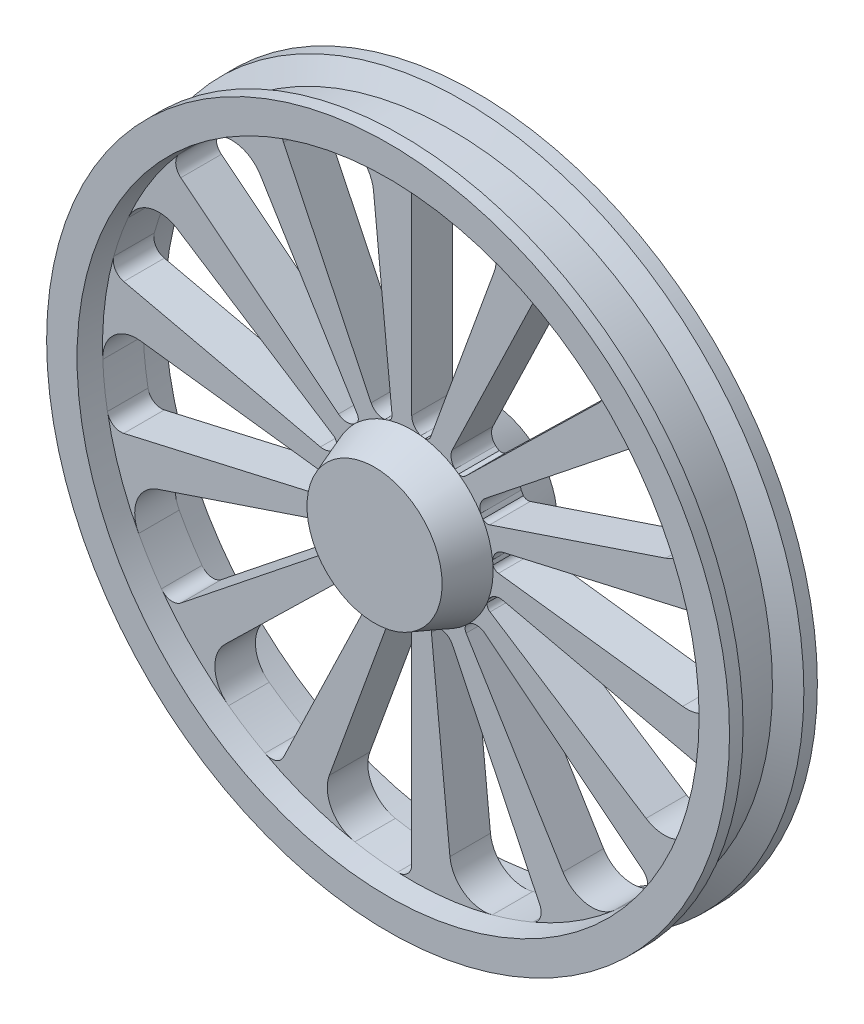
from build123d import *

# Parameters (mm, degrees)
CUT_EXTRUDE1_DEPTH = 265


with BuildPart() as part:
    # Sketch1 → Revolve1 (revolve)
    with BuildSketch(Plane(origin=(0, 0, 0), x_dir=(0, 0, -1), z_dir=(1, 0, 0)), mode=Mode.PRIVATE) as revolve1_sk:
        Polygon((-85, 0), (-85, 100), (-30, 120.407271829), (-30, 457.5), (-65, 460.254556655), (-65, 505.254556655), (-45, 505.254556655), (-28.508256592, 475.254556655), (28.508256592, 475.254556655), (45, 505.254556655), (65, 505.254556655), (65, 460.254556655), (30, 457.5), (30, 120.407271829), (85, 100), (85, 0), align=None)
    revolve(revolve1_sk.sketch.rotate(Axis((0, 0, 374.636327729), (0, 0, -1)), 90), axis=Axis((0, 0, 374.636327729), (0, 0, -1)))

    # Sketch2 → Cut-Extrude1 (cut)
    with BuildSketch(Plane.XY.offset(30)):
        with BuildLine():
            ThreePointArc((0, 138.564064606), (3.723460634, 126.941919095), (13.507426626, 119.647233714))
            ThreePointArc((13.507426626, 119.647233714), (16.703287524, 119.243076509), (19.887193054, 118.753571154))
            ThreePointArc((19.887193054, 118.753571154), (24.834793435, 120.871103176), (27.968354779, 125.246429986))
            Line((27.968354779, 125.246429986), (121.944990015, 383.445113252))
            ThreePointArc((121.944990015, 383.445113252), (118.391940375, 425.319043886), (84.157949034, 449.69288366))
            ThreePointArc((84.157949034, 449.69288366), (52.663759357, 454.458775304), (20.914285714, 457.02170917))
            ThreePointArc((20.914285714, 457.02170917), (6.184894396, 451.504390328), (0, 437.042618059))
            Line((0, 437.042618059), (0, 138.564064606))
        make_face()
        with BuildLine():
            ThreePointArc((60.120694458, 124.84190842), (58.43275662, 112.755168114), (64.082760015, 101.937779936))
            ThreePointArc((64.082760015, 101.937779936), (66.78677395, 100.187014801), (69.442985298, 98.364540879))
            ThreePointArc((69.442985298, 98.364540879), (74.819381923, 98.125687955), (79.541006296, 100.708119885))
            Line((79.541006296, 100.708119885), (276.239239084, 292.562161355))
            ThreePointArc((276.239239084, 292.562161355), (291.206469568, 331.830879696), (270.938121883, 368.644522692))
            ThreePointArc((270.938121883, 368.644522692), (244.630680351, 386.603259468), (217.137408356, 402.687963431))
            ThreePointArc((217.137408356, 402.687963431), (201.472810405, 404.1078743), (189.625685277, 393.761792818))
            Line((189.625685277, 393.761792818), (60.120694458, 124.84190842))
        make_face()
        with BuildLine():
            ThreePointArc((108.333748047, 86.393281186), (101.568728526, 76.235873237), (101.965716859, 64.038298657))
            ThreePointArc((101.965716859, 64.038298657), (103.64232071, 61.287686099), (105.244742641, 58.493206921))
            ThreePointArc((105.244742641, 58.493206921), (109.985074222, 55.945276802), (115.35958601, 56.223331536))
            Line((115.35958601, 56.223331536), (375.820919001, 143.733685362))
            ThreePointArc((375.820919001, 143.733685362), (406.343986049, 172.619540143), (404.055676855, 214.581592876))
            ThreePointArc((404.055676855, 214.581592876), (388.145494903, 242.176226717), (370.353804257, 268.596927891))
            ThreePointArc((370.353804257, 268.596927891), (356.856565412, 276.672837709), (341.693677979, 272.491615338))
            Line((341.693677979, 272.491615338), (108.333748047, 86.393281186))
        make_face()
        with BuildLine():
            ThreePointArc((135.089974209, 30.833405069), (124.58776809, 24.617128693), (119.653112951, 13.455246951))
            ThreePointArc((119.653112951, 13.455246951), (119.970234763, 10.249579521), (120.201487962, 7.03657596))
            ThreePointArc((120.201487962, 7.03657596), (123.366873693, 2.684217454), (128.329784921, 0.602822843))
            Line((128.329784921, 0.602822843), (400.966656769, -33.563009794))
            ThreePointArc((400.966656769, -33.563009794), (441.000092612, -20.781216374), (457.145049608, 18.01814692))
            ThreePointArc((457.145049608, 18.01814692), (454.783333897, 49.783222168), (450.217087133, 81.306976657))
            ThreePointArc((450.217087133, 81.306976657), (441.56050108, 94.439352441), (426.085047159, 97.251131549))
            Line((426.085047159, 97.251131549), (135.089974209, 30.833405069))
        make_face()
        with BuildLine():
            ThreePointArc((346.69603063, -204.212139238), (388.310722322, -210.065998124), (419.691238771, -182.114014011))
            ThreePointArc((419.691238771, -182.114014011), (431.345756062, -152.469960083), (440.909354353, -122.086818469))
            ThreePointArc((440.909354353, -122.086818469), (438.807964126, -106.499004801), (426.085047159, -97.251131549))
            Line((426.085047159, -97.251131549), (135.089974209, -30.833405069))
            ThreePointArc((135.089974209, -30.833405069), (122.930672214, -31.877340097), (113.641742575, -39.792781431))
            ThreePointArc((113.641742575, -39.792781431), (112.536572483, -42.818581985), (111.350854417, -45.813735168))
            ThreePointArc((111.350854417, -45.813735168), (112.314350833, -51.10848408), (115.882696068, -55.137082307))
            Line((115.882696068, -55.137082307), (346.69603063, -204.212139238))
        make_face()
        with BuildLine():
            ThreePointArc((223.758003677, -334.414550008), (258.711651157, -357.744632655), (299.112430919, -346.176260985))
            ThreePointArc((299.112430919, -346.176260985), (322.47486113, -324.524596817), (344.274116545, -301.299821901))
            ThreePointArc((344.274116545, -301.299821901), (349.144128249, -286.343928018), (341.693677979, -272.491615338))
            Line((341.693677979, -272.491615338), (108.333748047, -86.393281186))
            ThreePointArc((108.333748047, -86.393281186), (96.925649061, -82.058110732), (85.122231357, -85.159361425))
            ThreePointArc((85.122231357, -85.159361425), (82.813661852, -87.405998192), (80.445818527, -89.590074177))
            ThreePointArc((80.445818527, -89.590074177), (79.016593346, -94.778523538), (80.48361805, -99.956412095))
            Line((80.48361805, -99.956412095), (223.758003677, -334.414550008))
        make_face()
        with BuildLine():
            ThreePointArc((56.501959884, -398.382057824), (77.871564591, -434.567555239), (119.290737751, -441.674053898))
            ThreePointArc((119.290737751, -441.674053898), (149.733865056, -432.303157119), (179.45116771, -420.836700405))
            ThreePointArc((179.45116771, -420.836700405), (190.328015801, -409.474924513), (189.625685277, -393.761792818))
            Line((189.625685277, -393.761792818), (60.120694458, -124.84190842))
            ThreePointArc((60.120694458, -124.84190842), (51.723312396, -115.986266159), (39.743218263, -113.659085477))
            ThreePointArc((39.743218263, -113.659085477), (36.688489849, -114.681584494), (33.607501674, -115.622000245))
            ThreePointArc((33.607501674, -115.622000245), (30.068630472, -119.676514027), (29.143772411, -124.978148582))
            Line((29.143772411, -124.978148582), (56.501959884, -398.382057824))
        make_face()
        with BuildLine():
            ThreePointArc((-20.914285714, -457.02170917), (-6.184894396, -451.504390328), (0, -437.042618059))
            Line((0, -437.042618059), (0, -138.564064606))
            ThreePointArc((0, -138.564064606), (-3.723460634, -126.941919095), (-13.507426626, -119.647233714))
            ThreePointArc((-13.507426626, -119.647233714), (-16.703287524, -119.243076509), (-19.887193054, -118.753571154))
            ThreePointArc((-19.887193054, -118.753571154), (-24.834793435, -120.871103176), (-27.968354779, -125.246429986))
            Line((-27.968354779, -125.246429986), (-121.944990015, -383.445113252))
            ThreePointArc((-121.944990015, -383.445113252), (-118.391940375, -425.319043886), (-84.157949034, -449.69288366))
            ThreePointArc((-84.157949034, -449.69288366), (-52.663759357, -454.458775304), (-20.914285714, -457.02170917))
        make_face()
        with BuildLine():
            ThreePointArc((-270.938121883, -368.644522692), (-244.630680351, -386.603259468), (-217.137408356, -402.687963431))
            ThreePointArc((-217.137408356, -402.687963431), (-201.472810405, -404.1078743), (-189.625685277, -393.761792818))
            Line((-189.625685277, -393.761792818), (-60.120694458, -124.84190842))
            ThreePointArc((-60.120694458, -124.84190842), (-58.43275662, -112.755168114), (-64.082760015, -101.937779936))
            ThreePointArc((-64.082760015, -101.937779936), (-66.78677395, -100.187014801), (-69.442985298, -98.364540879))
            ThreePointArc((-69.442985298, -98.364540879), (-74.819381923, -98.125687955), (-79.541006296, -100.708119885))
            Line((-79.541006296, -100.708119885), (-276.239239084, -292.562161355))
            ThreePointArc((-276.239239084, -292.562161355), (-291.206469568, -331.830879696), (-270.938121883, -368.644522692))
        make_face()
        with BuildLine():
            ThreePointArc((-404.055676855, -214.581592876), (-388.145494903, -242.176226717), (-370.353804257, -268.596927891))
            ThreePointArc((-370.353804257, -268.596927891), (-356.856565412, -276.672837709), (-341.693677979, -272.491615337))
            Line((-341.693677979, -272.491615337), (-108.333748047, -86.393281186))
            ThreePointArc((-108.333748047, -86.393281186), (-101.568728526, -76.235873237), (-101.965716859, -64.038298657))
            ThreePointArc((-101.965716859, -64.038298657), (-103.64232071, -61.287686099), (-105.244742641, -58.493206921))
            ThreePointArc((-105.244742641, -58.493206921), (-109.985074222, -55.945276802), (-115.35958601, -56.223331536))
            Line((-115.35958601, -56.223331536), (-375.820919001, -143.733685362))
            ThreePointArc((-375.820919001, -143.733685362), (-406.34398605, -172.619540143), (-404.055676855, -214.581592876))
        make_face()
        with BuildLine():
            ThreePointArc((-135.089974209, -30.833405069), (-124.58776809, -24.617128693), (-119.653112951, -13.455246951))
            ThreePointArc((-119.653112951, -13.455246951), (-119.970234763, -10.249579521), (-120.201487962, -7.03657596))
            ThreePointArc((-120.201487962, -7.03657596), (-123.366873693, -2.684217454), (-128.329784921, -0.602822843))
            Line((-128.329784921, -0.602822843), (-400.966656769, 33.563009794))
            ThreePointArc((-400.966656769, 33.563009794), (-441.000092612, 20.781216374), (-457.145049609, -18.01814692))
            ThreePointArc((-457.145049609, -18.01814692), (-454.783333897, -49.783222168), (-450.217087133, -81.306976657))
            ThreePointArc((-450.217087133, -81.306976657), (-441.56050108, -94.439352441), (-426.085047159, -97.251131549))
            Line((-426.085047159, -97.251131549), (-135.089974209, -30.833405069))
        make_face()
        with BuildLine():
            ThreePointArc((-135.089974209, 30.833405069), (-122.930672214, 31.877340097), (-113.641742575, 39.792781431))
            ThreePointArc((-113.641742575, 39.792781431), (-112.536572483, 42.818581985), (-111.350854417, 45.813735168))
            ThreePointArc((-111.350854417, 45.813735168), (-112.314350833, 51.10848408), (-115.882696068, 55.137082307))
            Line((-115.882696068, 55.137082307), (-346.69603063, 204.212139238))
            ThreePointArc((-346.69603063, 204.212139238), (-388.310722322, 210.065998124), (-419.691238771, 182.114014011))
            ThreePointArc((-419.691238771, 182.114014011), (-431.345756062, 152.469960083), (-440.909354353, 122.086818469))
            ThreePointArc((-440.909354353, 122.086818469), (-438.807964126, 106.499004801), (-426.085047159, 97.251131549))
            Line((-426.085047159, 97.251131549), (-135.089974209, 30.833405069))
        make_face()
        with BuildLine():
            ThreePointArc((-108.333748047, 86.393281186), (-96.925649061, 82.058110732), (-85.122231357, 85.159361425))
            ThreePointArc((-85.122231357, 85.159361425), (-82.813661852, 87.405998192), (-80.445818527, 89.590074177))
            ThreePointArc((-80.445818527, 89.590074177), (-79.016593346, 94.778523538), (-80.48361805, 99.956412095))
            Line((-80.48361805, 99.956412095), (-223.758003677, 334.414550008))
            ThreePointArc((-223.758003677, 334.414550008), (-258.711651157, 357.744632655), (-299.112430919, 346.176260985))
            ThreePointArc((-299.112430919, 346.176260985), (-322.47486113, 324.524596817), (-344.274116545, 301.299821901))
            ThreePointArc((-344.274116545, 301.299821901), (-349.144128249, 286.343928018), (-341.693677979, 272.491615338))
            Line((-341.693677979, 272.491615338), (-108.333748047, 86.393281186))
        make_face()
        with BuildLine():
            ThreePointArc((-60.120694458, 124.84190842), (-51.723312396, 115.986266159), (-39.743218263, 113.659085477))
            ThreePointArc((-39.743218263, 113.659085477), (-36.688489849, 114.681584494), (-33.607501674, 115.622000245))
            ThreePointArc((-33.607501674, 115.622000245), (-30.068630472, 119.676514027), (-29.143772411, 124.978148582))
            Line((-29.143772411, 124.978148582), (-56.501959884, 398.382057824))
            ThreePointArc((-56.501959884, 398.382057824), (-77.87156459, 434.567555239), (-119.290737751, 441.674053898))
            ThreePointArc((-119.290737751, 441.674053898), (-149.733865056, 432.303157119), (-179.45116771, 420.836700405))
            ThreePointArc((-179.45116771, 420.836700405), (-190.328015801, 409.474924513), (-189.625685277, 393.761792818))
            Line((-189.625685277, 393.761792818), (-60.120694458, 124.84190842))
        make_face()
    extrude(amount=-CUT_EXTRUDE1_DEPTH, mode=Mode.SUBTRACT)


solid = part.part
